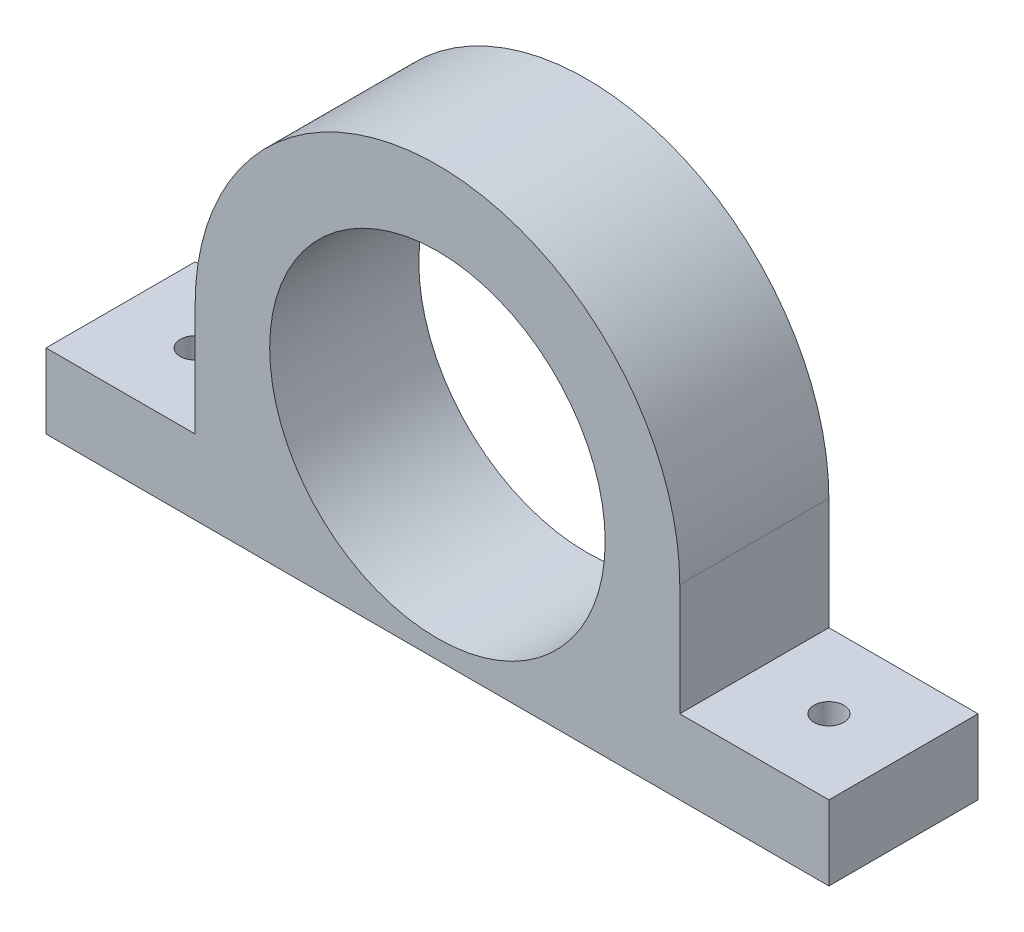
from build123d import *

# Parameters (mm, degrees)
SKETCH1_R             = 22.5
BOSS_EXTRUDE2_DEPTH   = 20
F_4_0MM_DOWEL_HOLE1_D = 4


with BuildPart() as part:
    # Sketch1 → Boss-Extrude2 (new body)
    with BuildSketch(Plane.XY.offset(-167.5)):
        with BuildLine():
            Line((-32.5, 0), (-32.5, -15))
            Line((-32.5, -15), (-52.5, -15))
            Line((-52.5, -15), (-52.5, -25))
            Line((-52.5, -25), (52.5, -25))
            Line((52.5, -25), (52.5, -15))
            Line((52.5, -15), (32.5, -15))
            Line((32.5, -15), (32.5, 0))
            ThreePointArc((32.5, 0), (0, 32.5), (-32.5, 0))
        make_face()
        Circle(SKETCH1_R, mode=Mode.SUBTRACT)
    extrude(amount=-BOSS_EXTRUDE2_DEPTH)

    # Ø4.0mm Dowel Hole1 (through all)
    with Locations(Plane(origin=(0, -15, 0), x_dir=(1, 0, 0), z_dir=(0, 1, 0))):
        with Locations((42.5, 177.5), (-42.5, 177.5)):
            Hole(F_4_0MM_DOWEL_HOLE1_D / 2)


solid = part.part
